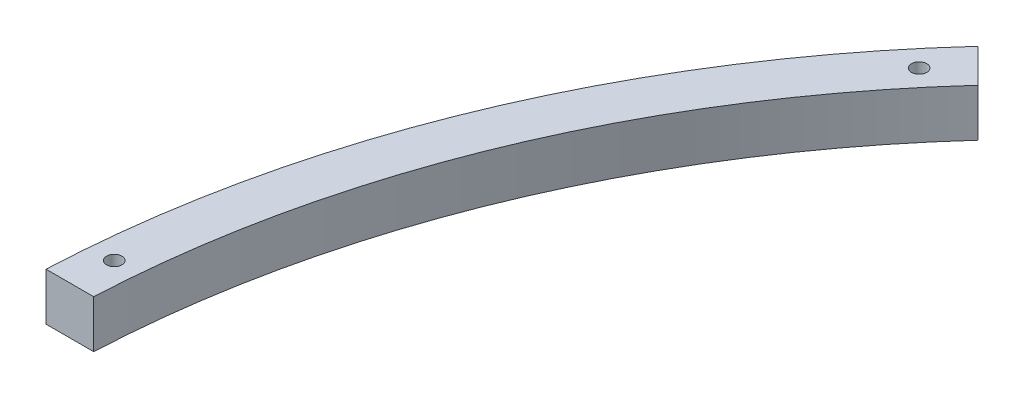
from build123d import *

# Parameters (mm, degrees)
BASE_DEPTH                 = 5
F_3_2_3_2_DIAMETER_HOLE1_D = 3.2


with BuildPart() as part:
    # Sketch1 → base (new, symmetric)
    with BuildSketch(Plane(origin=(0, 0, 0), x_dir=(1, 0, 0), z_dir=(0, 1, 0))):
        with BuildLine():
            Line((-155.395037554, 141.25290193), (-162.473770491, 148.331634867))
            ThreePointArc((-162.473770491, 148.331634867), (-203.253497152, 84.19035512), (-219.772609758, 10))
            Line((-219.772609758, 10), (-209.761769634, 10))
            ThreePointArc((-209.761769634, 10), (-194.014701827, 80.363520797), (-155.395037554, 141.25290193))
        make_face()
    extrude(amount=BASE_DEPTH, both=True)

    # Ø3.2 (3.2) Diameter Hole1 (through all)
    with Locations(Plane(origin=(0, 5, 0), x_dir=(1, 0, 0), z_dir=(0, 1, 0))):
        with Locations((-164.699555271, 138.199336083), (-214.18186009, 18.738484691)):
            Hole(F_3_2_3_2_DIAMETER_HOLE1_D / 2)


solid = part.part
